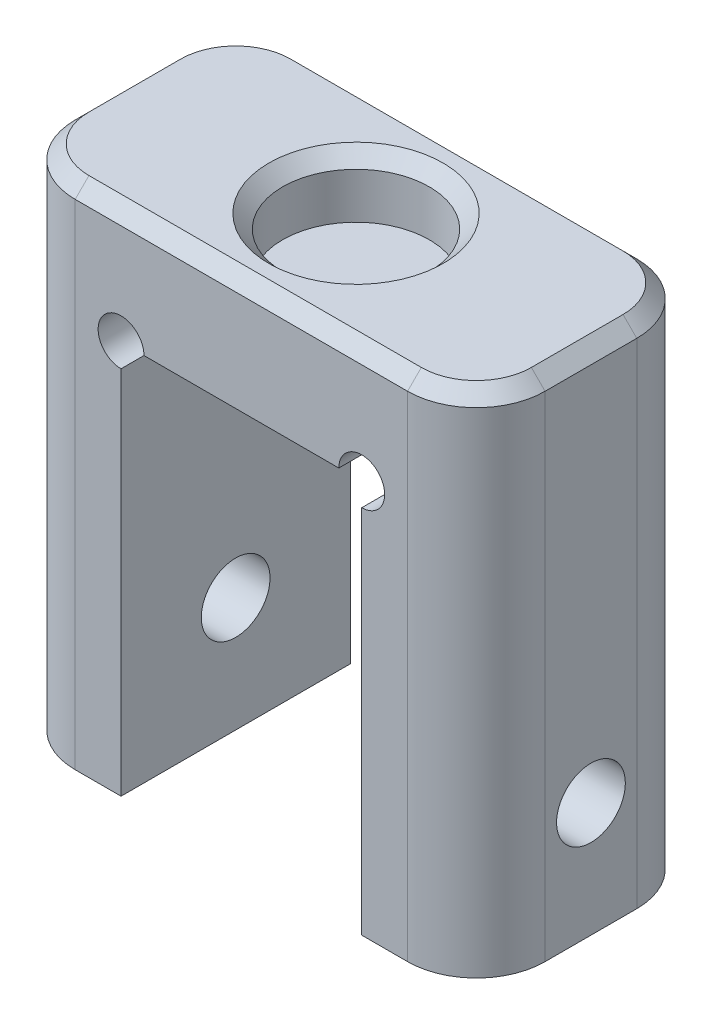
from build123d import *

# Parameters (mm, degrees)
EXTRUDE_1_DEPTH     = 10
SKETCH_2_R          = 3.2
CUT_EXTRUDE_1_DEPTH = 2.6
SKETCH_3_R          = 1.5
CUT_EXTRUDE_2_DEPTH = 26.355583705
FILLET_1_R          = 3
CHAMFER_1_SIZE      = 0.6
SKETCH_4_R          = 1
CUT_EXTRUDE_3_DEPTH = 19.102986632


with BuildPart() as part:
    # ｽｹｯﾁ1 → ﾎﾞｽ - 押し出し1 (new body)
    with BuildSketch(Plane.XY):
        Polygon((-10.25, 11.075), (-10.25, -11.075), (-5.25, -11.075), (-5.25, 6.075), (5.25, 6.075), (5.25, -11.075), (10.25, -11.075), (10.25, 11.075), align=None)
    extrude(amount=EXTRUDE_1_DEPTH)

    # ｽｹｯﾁ2 → ｶｯﾄ - 押し出し1 (cut)
    with BuildSketch(Plane(origin=(0, 11.075, 0), x_dir=(1, 0, 0), z_dir=(0, 1, 0))):
        with Locations(Location((0, -5, 0), (0, 0, 180))):
            Circle(SKETCH_2_R)
    extrude(amount=-CUT_EXTRUDE_1_DEPTH, mode=Mode.SUBTRACT)

    # ｽｹｯﾁ3 → ｶｯﾄ - 押し出し2 (cut, through all)
    with BuildSketch(Plane(origin=(10.25, 0, 0), x_dir=(0, 0, -1), z_dir=(1, 0, 0))):
        with Locations(Location((-5, -6.075, 0), (0, 0, 90))):
            Circle(SKETCH_3_R)
    extrude(amount=-CUT_EXTRUDE_2_DEPTH, mode=Mode.SUBTRACT)

    # ﾌｨﾚｯﾄ1
    fillet_1_edges = [part.edges().sort_by_distance(p)[0] for p in [
        (-10.25, 0, 0),
        (10.25, 0, 0),
        (10.25, 0, 10),
        (-10.25, 0, 10),
    ]]
    fillet(fillet_1_edges, radius=FILLET_1_R)

    # 面取り1
    chamfer_1_edges = [part.edges().sort_by_distance(p)[0] for p in [
        (3.2, 11.075, 5),
        (-10.25, 11.075, 5),
        (0, 11.075, 0),
        (0, 11.075, 10),
        (10.25, 11.075, 5),
        (9.371320344, 11.075, 9.121320344),
        (9.371320344, 11.075, 0.878679656),
        (-9.371320344, 11.075, 0.878679656),
        (-9.371320344, 11.075, 9.121320344),
    ]]
    chamfer(chamfer_1_edges, length=CHAMFER_1_SIZE)

    # ｽｹｯﾁ4 → ｶｯﾄ - 押し出し3 (cut, through all)
    with BuildSketch(Plane.XY.offset(10)):
        with Locations((5.25, 6.075)):
            Circle(SKETCH_4_R)
        with Locations((-5.25, 6.075)):
            Circle(SKETCH_4_R)
    extrude(amount=-CUT_EXTRUDE_3_DEPTH, mode=Mode.SUBTRACT)


solid = part.part
